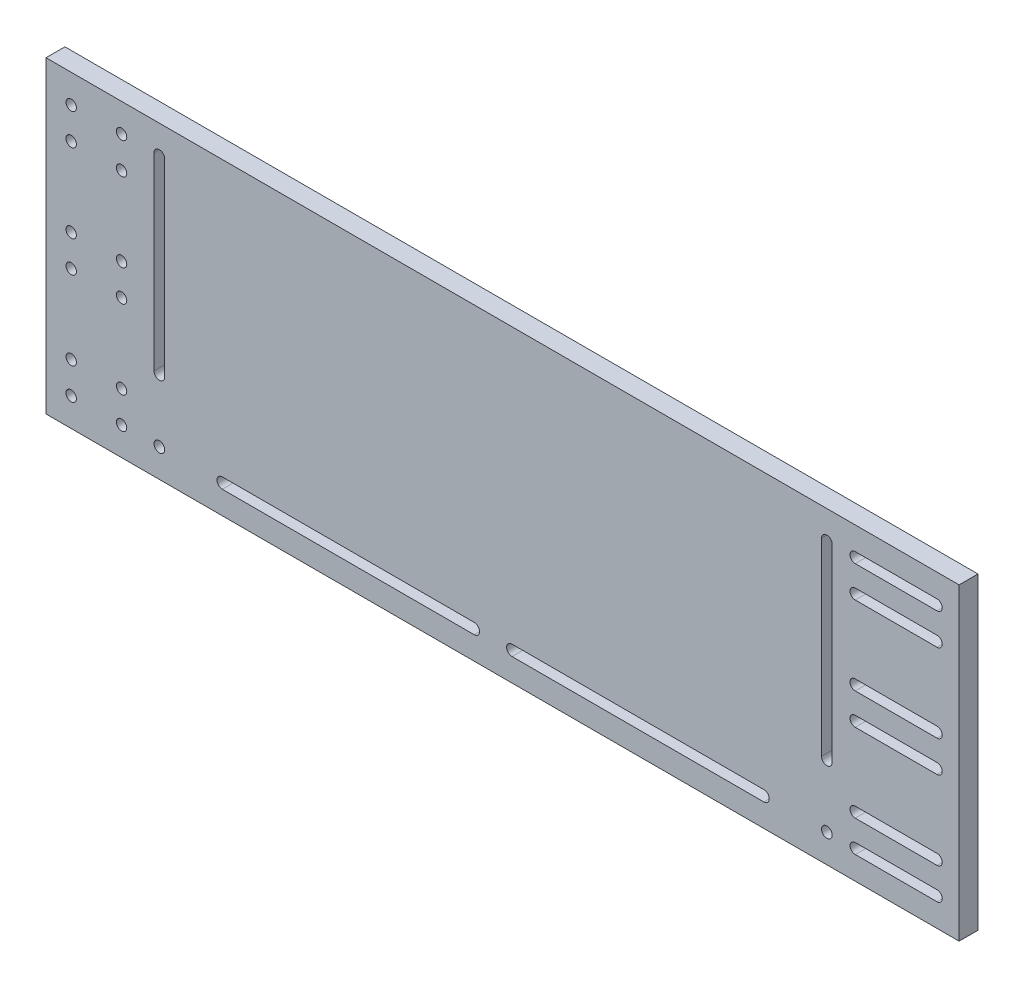
from build123d import *

# Parameters (mm, degrees)
SKETCH1_W           = 290
SKETCH1_H           = 98
SKETCH1_R           = 1.65
SKETCH1_R_2         = 1.7
BOSS_EXTRUDE1_DEPTH = 6


with BuildPart() as part:
    # Sketch1 → Boss-Extrude1 (new body)
    with BuildSketch(Plane(origin=(0, 0, -9.5), x_dir=(-1, 0, 0), z_dir=(0, 0, -1))):
        with Locations((127, 40)):
            Rectangle(SKETCH1_W, SKETCH1_H)
        with Locations(Location((264, 0, 0), (0, 0, 180))):
            Circle(SKETCH1_R, mode=Mode.SUBTRACT)
        with Locations(Location((248, 0, 0), (0, 0, 180))):
            Circle(SKETCH1_R, mode=Mode.SUBTRACT)
        with Locations(Location((248, 10, 0), (0, 0, 180))):
            Circle(SKETCH1_R, mode=Mode.SUBTRACT)
        with Locations(Location((264, 10, 0), (0, 0, 180))):
            Circle(SKETCH1_R, mode=Mode.SUBTRACT)
        with Locations(Location((248, 45.003288428, 0), (0, 0, 180))):
            Circle(SKETCH1_R, mode=Mode.SUBTRACT)
        with Locations(Location((264, 35.003288428, 0), (0, 0, 180))):
            Circle(SKETCH1_R, mode=Mode.SUBTRACT)
        with Locations(Location((248, 80, 0), (0, 0, 180))):
            Circle(SKETCH1_R, mode=Mode.SUBTRACT)
        with Locations(Location((264, 70, 0), (0, 0, 180))):
            Circle(SKETCH1_R, mode=Mode.SUBTRACT)
        with Locations(Location((24, 0, 0), (0, 0, 180))):
            Circle(SKETCH1_R_2, mode=Mode.SUBTRACT)
        with Locations(Location((236, 0, 0), (0, 0, 180))):
            Circle(SKETCH1_R_2, mode=Mode.SUBTRACT)
        with Locations(Location((248, 70, 0), (0, 0, 180))):
            Circle(SKETCH1_R, mode=Mode.SUBTRACT)
        with Locations(Location((264, 80, 0), (0, 0, 180))):
            Circle(SKETCH1_R, mode=Mode.SUBTRACT)
        with Locations(Location((248, 35.003288428, 0), (0, 0, 180))):
            Circle(SKETCH1_R, mode=Mode.SUBTRACT)
        with Locations(Location((264, 45.003288428, 0), (0, 0, 180))):
            Circle(SKETCH1_R, mode=Mode.SUBTRACT)
        with BuildLine():
            Line((-11, 71.65), (15, 71.65))
            ThreePointArc((15, 71.65), (16.65, 70), (15, 68.35))
            Line((15, 68.35), (-11, 68.35))
            ThreePointArc((-11, 68.35), (-12.65, 70), (-11, 71.65))
        make_face(mode=Mode.SUBTRACT)
        with BuildLine():
            Line((-11, 81.65), (15, 81.65))
            ThreePointArc((15, 81.65), (16.65, 80), (15, 78.35))
            Line((15, 78.35), (-11, 78.35))
            ThreePointArc((-11, 78.35), (-12.65, 80), (-11, 81.65))
        make_face(mode=Mode.SUBTRACT)
        with BuildLine():
            Line((15, -1.65), (-11, -1.65))
            ThreePointArc((-11, -1.65), (-12.65, 0), (-11, 1.65))
            Line((-11, 1.65), (15, 1.65))
            ThreePointArc((15, 1.65), (16.65, 0), (15, -1.65))
        make_face(mode=Mode.SUBTRACT)
        with BuildLine():
            Line((15, 8.35), (-11, 8.35))
            ThreePointArc((-11, 8.35), (-12.65, 10), (-11, 11.65))
            Line((-11, 11.65), (15, 11.65))
            ThreePointArc((15, 11.65), (16.65, 10), (15, 8.35))
        make_face(mode=Mode.SUBTRACT)
        with BuildLine():
            Line((124, -1.7), (44, -1.7))
            ThreePointArc((44, -1.7), (42.3, 0), (44, 1.7))
            Line((44, 1.7), (124, 1.7))
            ThreePointArc((124, 1.7), (125.7, 0), (124, -1.7))
        make_face(mode=Mode.SUBTRACT)
        with BuildLine():
            Line((25.7, 80), (25.7, 20))
            ThreePointArc((25.7, 20), (24, 18.3), (22.3, 20))
            Line((22.3, 20), (22.3, 80))
            ThreePointArc((22.3, 80), (24, 81.7), (25.7, 80))
        make_face(mode=Mode.SUBTRACT)
        with BuildLine():
            Line((216, -1.7), (136, -1.7))
            ThreePointArc((136, -1.7), (134.3, 0), (136, 1.7))
            Line((136, 1.7), (216, 1.7))
            ThreePointArc((216, 1.7), (217.7, 0), (216, -1.7))
        make_face(mode=Mode.SUBTRACT)
        with BuildLine():
            Line((237.7, 80), (237.7, 20))
            ThreePointArc((237.7, 20), (236, 18.3), (234.3, 20))
            Line((234.3, 20), (234.3, 80))
            ThreePointArc((234.3, 80), (236, 81.7), (237.7, 80))
        make_face(mode=Mode.SUBTRACT)
        with BuildLine():
            Line((15, 33.346711572), (-11, 33.346711572))
            ThreePointArc((-11, 33.346711572), (-12.65, 34.996711572), (-11, 36.646711572))
            Line((-11, 36.646711572), (15, 36.646711572))
            ThreePointArc((15, 36.646711572), (16.65, 34.996711572), (15, 33.346711572))
        make_face(mode=Mode.SUBTRACT)
        with BuildLine():
            Line((15, 43.346711572), (-11, 43.346711572))
            ThreePointArc((-11, 43.346711572), (-12.65, 44.996711572), (-11, 46.646711572))
            Line((-11, 46.646711572), (15, 46.646711572))
            ThreePointArc((15, 46.646711572), (16.65, 44.996711572), (15, 43.346711572))
        make_face(mode=Mode.SUBTRACT)
    extrude(amount=-BOSS_EXTRUDE1_DEPTH)


solid = part.part
